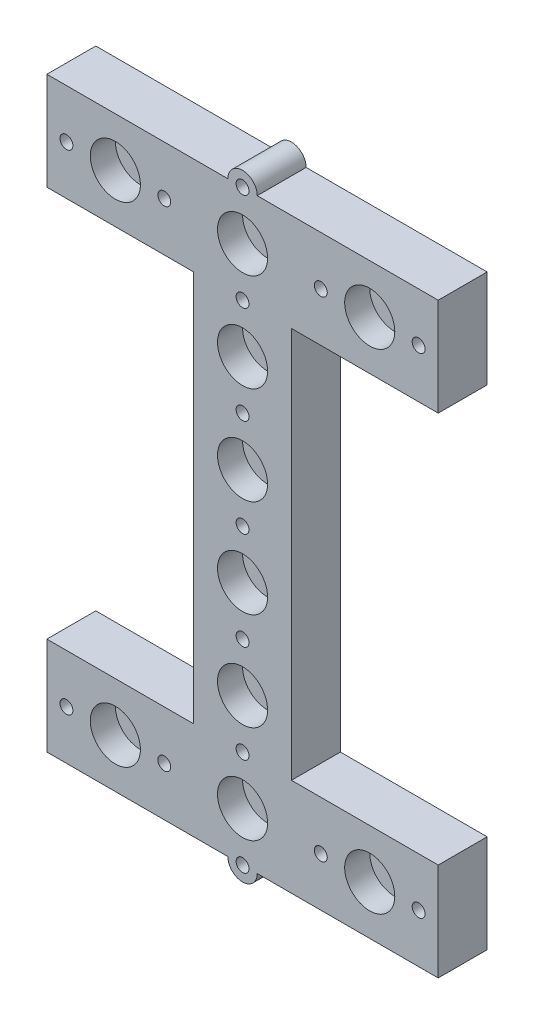
from build123d import *

# Parameters (mm, degrees)
HALFBODY_DEPTH                 = 25
CORNERHOLESGUIDE_R             = 12.8
CORNERHOLES_DEPTH              = 12.8
PATTERNCORNERHOLES_COUNT       = 2
PATTERNCORNERHOLES_PITCH       = 130
PATTERNCORNERHOLES_COUNT_DIR2  = 2
PATTERNCORNERHOLES_PITCH_DIR2  = 250
CENTERHOLESGUIDE_R             = 12.8
CENTERHOLES_DEPTH              = 12.8
PATTERNCENTERHOLES_COUNT       = 6
PATTERNCENTERHOLES_PITCH       = 50
CBORE_FOR_M6_SHCS1_D           = 6.6
CBORE_FOR_M6_SHCS1_CBORE_D     = 11.8
CBORE_FOR_M6_SHCS1_CBORE_DEPTH = 6


with BuildPart() as part:
    # Base → HalfBody (new body)
    with BuildSketch(Plane.XY):
        with BuildLine():
            Line((-25, 100), (-25, -100))
            Line((-25, -100), (-100, -100))
            Line((-100, -100), (-100, -150))
            Line((-100, -150), (-7.5, -150))
            ThreePointArc((-7.5, -150), (0, -157.5), (7.5, -150))
            Line((7.5, -150), (100, -150))
            Line((100, -150), (100, -100))
            Line((100, -100), (25, -100))
            Line((25, -100), (25, 100))
            Line((25, 100), (100, 100))
            Line((100, 100), (100, 150))
            Line((100, 150), (7.5, 150))
            ThreePointArc((7.5, 150), (0, 157.5), (-7.5, 150))
            Line((-7.5, 150), (-100, 150))
            Line((-100, 150), (-100, 100))
            Line((-100, 100), (-25, 100))
        make_face()
    extrude(amount=HALFBODY_DEPTH)

    # CornerHolesGuide → CornerHoles (cut)
    with BuildSketch(Plane.XY.offset(25)):
        with Locations((-65, 125)):
            Circle(CORNERHOLESGUIDE_R)
    cornerholes = extrude(amount=-CORNERHOLES_DEPTH, mode=Mode.SUBTRACT)

    # PatternCornerHoles: CornerHoles 2 × 2
    with Locations(*[(i * PATTERNCORNERHOLES_PITCH, -j * PATTERNCORNERHOLES_PITCH_DIR2, 0) for i in range(PATTERNCORNERHOLES_COUNT) for j in range(PATTERNCORNERHOLES_COUNT_DIR2) if (i, j) != (0, 0)]):
        add(cornerholes, mode=Mode.SUBTRACT)

    # CenterHolesGuide → CenterHoles (cut)
    with BuildSketch(Plane.XY.offset(25)):
        with Locations((0, 125)):
            Circle(CENTERHOLESGUIDE_R)
    centerholes = extrude(amount=-CENTERHOLES_DEPTH, mode=Mode.SUBTRACT)

    # PatternCenterHoles: CenterHoles ×6
    with Locations(*[(0, -i * PATTERNCENTERHOLES_PITCH, 0) for i in range(1, PATTERNCENTERHOLES_COUNT)]):
        add(centerholes, mode=Mode.SUBTRACT)

    # CBORE for M6 SHCS1 (through all)
    with Locations(Plane(origin=(0, 0, 0), x_dir=(-1, 0, 0), z_dir=(0, 0, -1))):
        with Locations((-90, 125), (-40, 125), (0, 150), (40, 125), (90, 125), (0, 50), (0, 0), (0, -50), (0, -100), (-90, -125), (-40, -125), (40, -125), (90, -125), (0, -150), (0, 100)):
            CounterBoreHole(CBORE_FOR_M6_SHCS1_D / 2, CBORE_FOR_M6_SHCS1_CBORE_D / 2, CBORE_FOR_M6_SHCS1_CBORE_DEPTH)


solid = part.part
